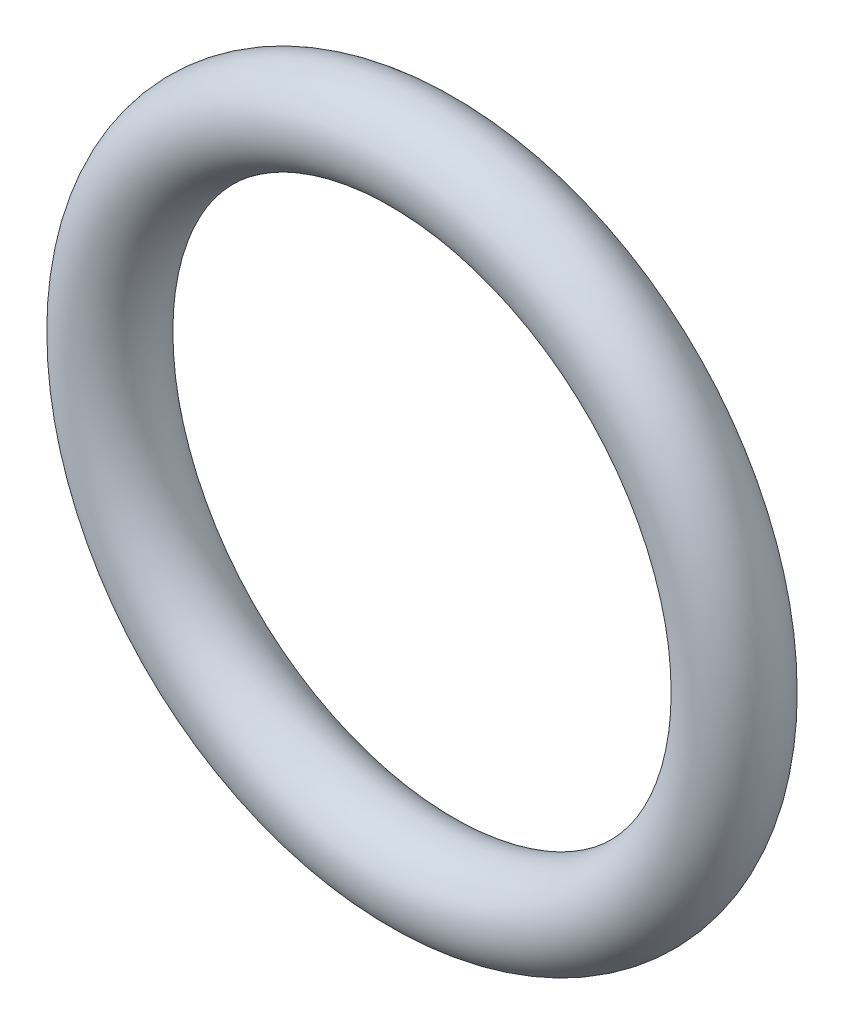
from build123d import *

# Parameters (mm, degrees)
SKETCH_1_R = 0.5


with BuildPart() as part:
    # Эскиз1 → Повернуть2 (revolve)
    with BuildSketch(Plane(origin=(0, 0, 0), x_dir=(0, 0, -1), z_dir=(1, 0, 0))):
        with Locations((0, 3.5)):
            Circle(SKETCH_1_R)
    revolve(axis=Axis((0, 0, -1.316983542), (0, 0, 1)))


solid = part.part
